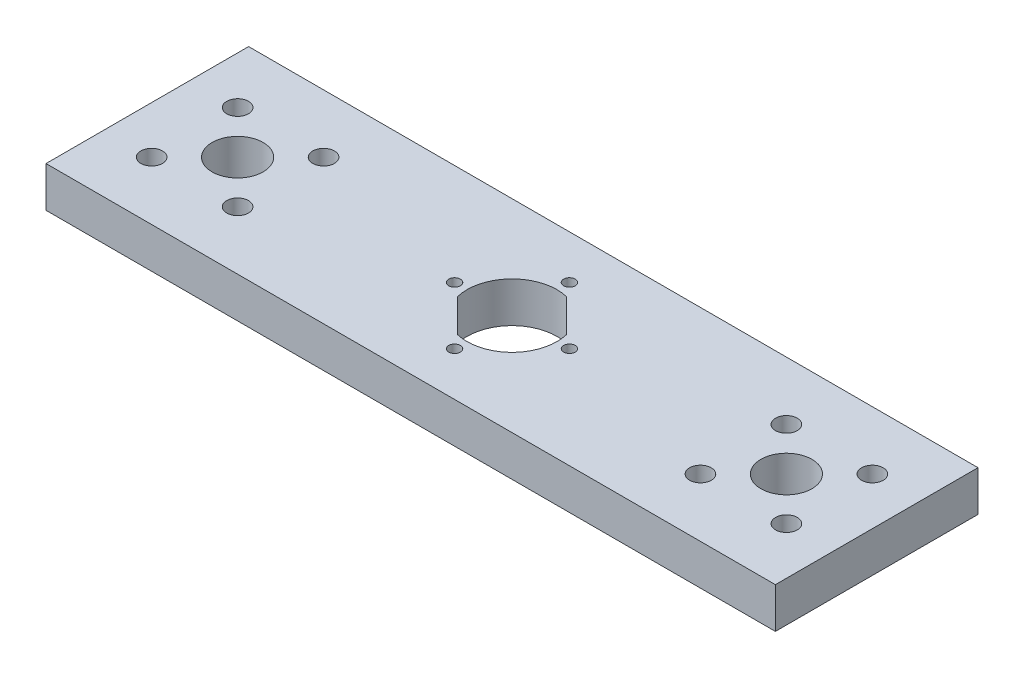
from build123d import *

# Parameters (mm, degrees)
SKETCH2_W           = 114.3
SKETCH2_H           = 31.75
SKETCH2_R           = 0.9115
SKETCH2_R_2         = 4
SKETCH2_R_3         = 1.7
BOSS_EXTRUDE1_DEPTH = 6.35


with BuildPart() as part:
    # Sketch2 → Boss-Extrude1 (new body)
    with BuildSketch(Plane(origin=(0, 0, 0), x_dir=(1, 0, 0), z_dir=(0, 1, 0))):
        Rectangle(SKETCH2_W, SKETCH2_H)
        with Locations(Location((-9.000000134, 0, 0), (0, 0, 270))):
            Circle(SKETCH2_R, mode=Mode.SUBTRACT)
        with Locations(Location((0, -9.000000134, 0), (0, 0, 270))):
            Circle(SKETCH2_R, mode=Mode.SUBTRACT)
        with Locations(Location((9.000000134, 0, 0), (0, 0, 270))):
            Circle(SKETCH2_R, mode=Mode.SUBTRACT)
        with Locations(Location((0, 9.000000134, 0), (0, 0, 270))):
            Circle(SKETCH2_R, mode=Mode.SUBTRACT)
        with Locations(Location((-43.000000106, 0, 0), (0, 0, 270))):
            Circle(SKETCH2_R_2, mode=Mode.SUBTRACT)
        with Locations(Location((43.000000106, 0, 0), (0, 0, 270))):
            Circle(SKETCH2_R_2, mode=Mode.SUBTRACT)
        with Locations(Location((-36.264808015, 6.735192091, 0), (0, 0, 270))):
            Circle(SKETCH2_R_3, mode=Mode.SUBTRACT)
        with Locations(Location((-49.735192197, 6.735192091, 0), (0, 0, 270))):
            Circle(SKETCH2_R_3, mode=Mode.SUBTRACT)
        with Locations(Location((-36.264808015, -6.735192091, 0), (0, 0, 270))):
            Circle(SKETCH2_R_3, mode=Mode.SUBTRACT)
        with Locations(Location((-49.735192197, -6.735192091, 0), (0, 0, 270))):
            Circle(SKETCH2_R_3, mode=Mode.SUBTRACT)
        with Locations(Location((49.735192197, -6.735192091, 0), (0, 0, 270))):
            Circle(SKETCH2_R_3, mode=Mode.SUBTRACT)
        with Locations(Location((36.264808015, -6.735192091, 0), (0, 0, 270))):
            Circle(SKETCH2_R_3, mode=Mode.SUBTRACT)
        with Locations(Location((36.264808015, 6.735192091, 0), (0, 0, 270))):
            Circle(SKETCH2_R_3, mode=Mode.SUBTRACT)
        with Locations(Location((49.735192197, 6.735192091, 0), (0, 0, 270))):
            Circle(SKETCH2_R_3, mode=Mode.SUBTRACT)
        with BuildLine():
            Line((6.79791666, 1.758075393), (1.758075393, 6.79791666))
            ThreePointArc((1.758075393, 6.79791666), (1.714608205, 6.830865544), (1.663855614, 6.850845531))
            ThreePointArc((1.663855614, 6.850845531), (-4.985102807, 4.985102807), (-6.850845531, -1.663855614))
            ThreePointArc((-6.850845531, -1.663855614), (-6.830865544, -1.714608205), (-6.79791666, -1.758075393))
            Line((-6.79791666, -1.758075393), (-1.758075393, -6.79791666))
            ThreePointArc((-1.758075393, -6.79791666), (-1.714608205, -6.830865544), (-1.663855614, -6.850845531))
            ThreePointArc((-1.663855614, -6.850845531), (4.985102807, -4.985102807), (6.850845531, 1.663855614))
            ThreePointArc((6.850845531, 1.663855614), (6.830865544, 1.714608205), (6.79791666, 1.758075393))
        make_face(mode=Mode.SUBTRACT)
    extrude(amount=BOSS_EXTRUDE1_DEPTH)


solid = part.part
